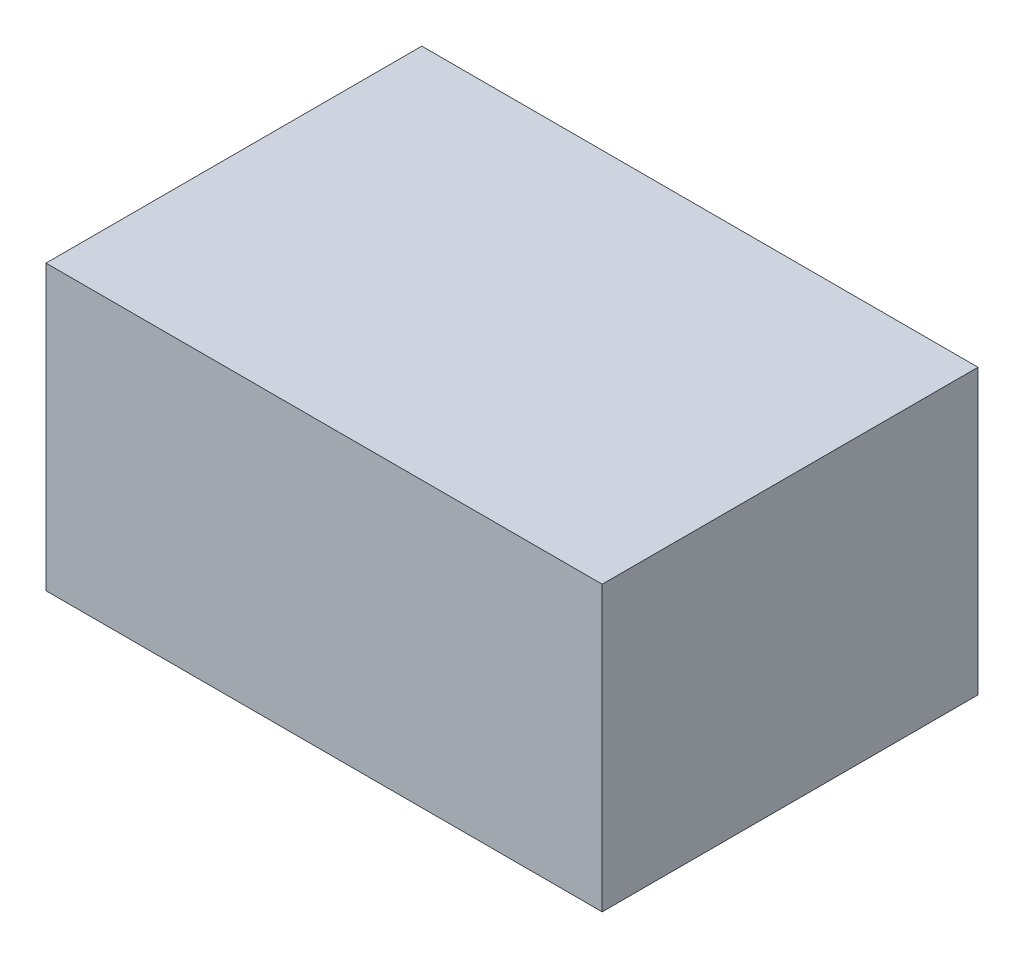
from build123d import *

# Parameters (mm, degrees)
SKETCH1_W           = 98.001411587
SKETCH1_H           = 66.216443784
BOSS_EXTRUDE1_DEPTH = 50


with BuildPart() as part:
    # Sketch1 → Boss-Extrude1 (new body)
    with BuildSketch(Plane(origin=(0, 0, 0), x_dir=(1, 0, 0), z_dir=(0, 1, 0))):
        with Locations((18.556792132, -16.498062082)):
            Rectangle(SKETCH1_W, SKETCH1_H)
    extrude(amount=BOSS_EXTRUDE1_DEPTH)


solid = part.part
